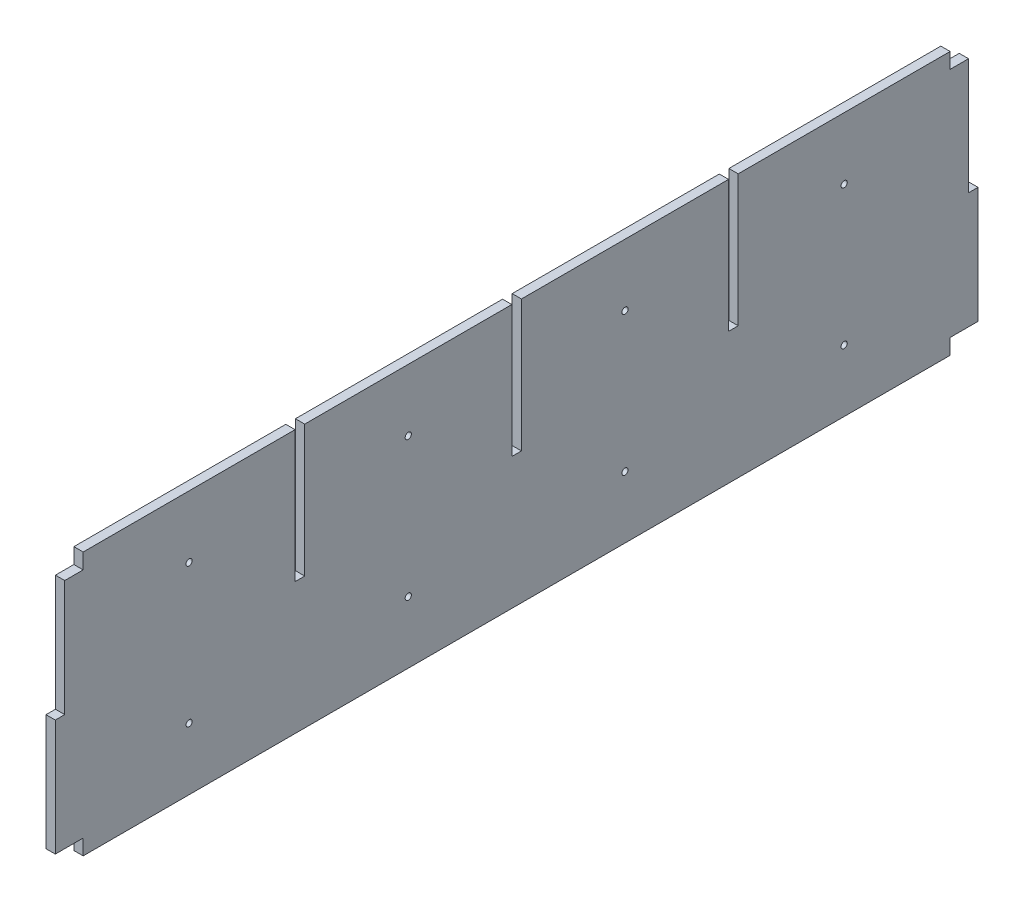
from build123d import *

# Parameters (mm, degrees)
BOSS_EXTRUDE1_DEPTH = 6
SKETCH2_W           = 6.2
SKETCH2_H           = 85
CUT_EXTRUDE1_DEPTH  = 6
SKETCH3_R           = 2
CUT_EXTRUDE2_DEPTH  = 6


with BuildPart() as part:
    # Sketch1 → Boss-Extrude1 (new body)
    with BuildSketch(Plane(origin=(0, 0, 0), x_dir=(0, 0, -1), z_dir=(1, 0, 0))):
        Polygon((0, 0), (560, 0), (560, 10), (578, 10), (578, 85), (571.9, 85), (571.9, 160), (560, 160), (560, 170), (0, 170), (0, 160), (-11.9, 160), (-11.9, 85), (-18, 85), (-18, 10), (0, 10), align=None)
    extrude(amount=BOSS_EXTRUDE1_DEPTH)

    # Sketch2 → Cut-Extrude1 (cut)
    with BuildSketch(Plane(origin=(6, 0, 0), x_dir=(0, 0, -1), z_dir=(1, 0, 0))):
        with Locations((140, 127.5)):
            Rectangle(SKETCH2_W, SKETCH2_H)
        with Locations((280, 127.5)):
            Rectangle(SKETCH2_W, SKETCH2_H)
        with Locations((420, 127.5)):
            Rectangle(SKETCH2_W, SKETCH2_H)
    extrude(amount=-CUT_EXTRUDE1_DEPTH, mode=Mode.SUBTRACT)

    # Sketch3 → Cut-Extrude2 (cut)
    with BuildSketch(Plane(origin=(6, 0, 0), x_dir=(0, 0, -1), z_dir=(1, 0, 0))):
        with Locations((68.45, 130)):
            Circle(SKETCH3_R)
        with Locations((68.45, 40)):
            Circle(SKETCH3_R)
        with Locations((210, 130)):
            Circle(SKETCH3_R)
        with Locations((210, 40)):
            Circle(SKETCH3_R)
        with Locations((350, 130)):
            Circle(SKETCH3_R)
        with Locations((350, 40)):
            Circle(SKETCH3_R)
        with Locations((491.55, 130)):
            Circle(SKETCH3_R)
        with Locations((491.55, 40)):
            Circle(SKETCH3_R)
    extrude(amount=-CUT_EXTRUDE2_DEPTH, mode=Mode.SUBTRACT)


solid = part.part
